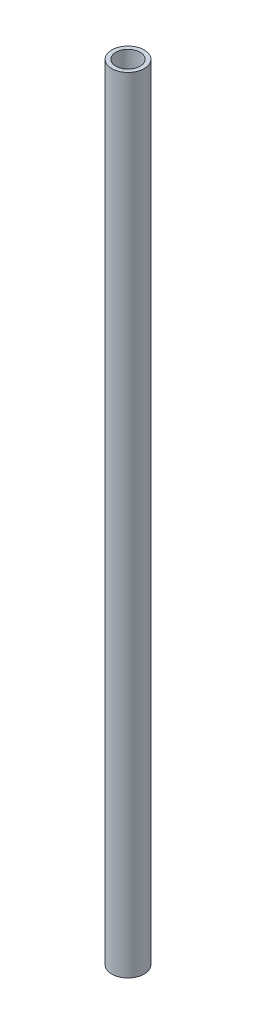
from build123d import *

# Parameters (mm, degrees)
SKETCH1_R           = 2.54
SKETCH1_R_2         = 1.905
BOSS_EXTRUDE1_DEPTH = 122.936


with BuildPart() as part:
    # Sketch1 → Boss-Extrude1 (new body)
    with BuildSketch(Plane(origin=(0, 0, 0), x_dir=(1, 0, 0), z_dir=(0, 1, 0))):
        with Locations(Location((0, 0, 0), (0, 0, 270))):
            Circle(SKETCH1_R)
        with Locations(Location((0, 0, 0), (0, 0, 270))):
            Circle(SKETCH1_R_2, mode=Mode.SUBTRACT)
    extrude(amount=BOSS_EXTRUDE1_DEPTH)


solid = part.part
